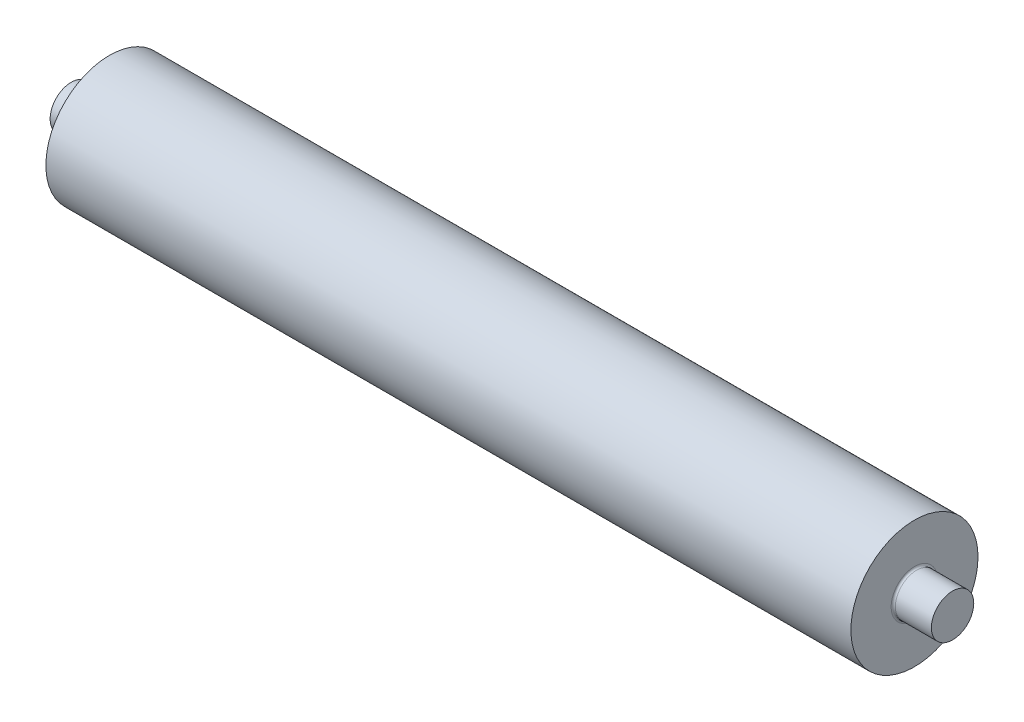
from build123d import *

# Parameters (mm, degrees)
FILLET1_R = 5


with BuildPart() as part:
    # Sketch1 → Revolve1 (revolve)
    with BuildSketch(Plane(origin=(0, 0, 0), x_dir=(1, 0, 0), z_dir=(0, 1, 0))):
        Polygon((1040, 0), (-1040, 0), (-1040, 50), (-950, 50), (-950, 150), (950, 150), (950, 50), (1040, 50), align=None)
    revolve(axis=Axis((1040, 0, 0), (-1, 0, 0)))

    # Fillet1
    fillet1_edges = [part.edges().sort_by_distance(p)[0] for p in [
        (-950, 0, 50),
        (950, 0, 50),
    ]]
    fillet(fillet1_edges, radius=FILLET1_R)


solid = part.part
